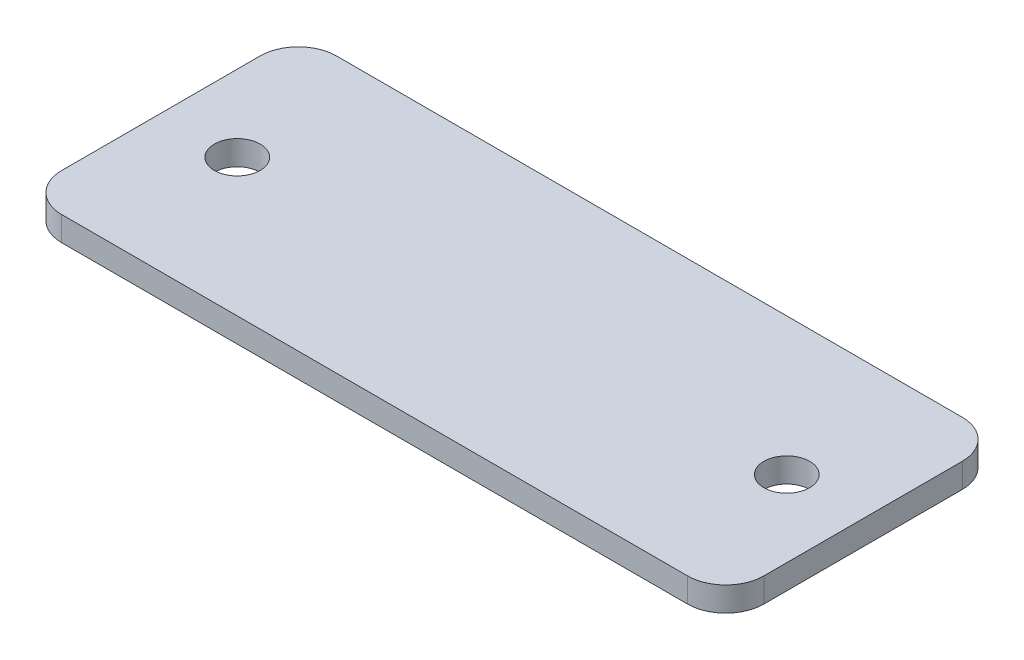
from build123d import *

# Parameters (mm, degrees)
SKETCH1_W           = 46
SKETCH1_H           = 18
SKETCH1_R           = 1.5
BOSS_EXTRUDE1_DEPTH = 1.6
FILLET1_R           = 2.5


with BuildPart() as part:
    # Sketch1 → Boss-Extrude1 (new body)
    with BuildSketch(Plane(origin=(0, 0, 0), x_dir=(1, 0, 0), z_dir=(0, 1, 0))):
        Rectangle(SKETCH1_W, SKETCH1_H)
        with Locations(Location((-18, 0, 0), (0, 0, 270))):
            Circle(SKETCH1_R, mode=Mode.SUBTRACT)
        with Locations(Location((18, 0, 0), (0, 0, 270))):
            Circle(SKETCH1_R, mode=Mode.SUBTRACT)
    extrude(amount=BOSS_EXTRUDE1_DEPTH)

    # Fillet1
    fillet1_edges = [part.edges().sort_by_distance(p)[0] for p in [
        (23, 0.8, 9),
        (-23, 0.8, 9),
        (-23, 0.8, -9),
        (23, 0.8, -9),
    ]]
    fillet(fillet1_edges, radius=FILLET1_R)


solid = part.part
